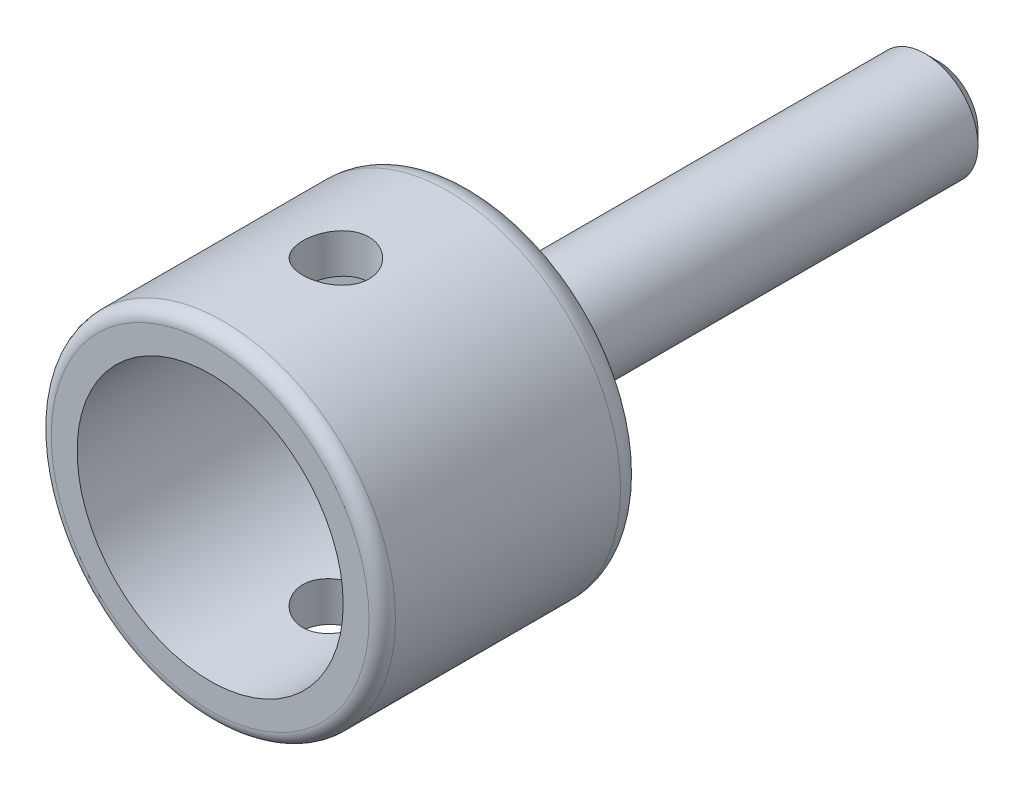
from build123d import *

# Parameters (mm, degrees)
SKETCH1_R           = 13
BOSS_EXTRUDE1_DEPTH = 20
SKETCH2_R           = 10.05
CUT_EXTRUDE1_DEPTH  = 15
SKETCH3_R           = 4
BOSS_EXTRUDE2_DEPTH = 35
FILLET1_R           = 2
CHAMFER1_SIZE       = 1
FILLET2_R           = 1
SKETCH4_R           = 2.5
CUT_EXTRUDE2_DEPTH  = 20


with BuildPart() as part:
    # Sketch1 → Boss-Extrude1 (new body)
    with BuildSketch(Plane.XY):
        Circle(SKETCH1_R)
    extrude(amount=BOSS_EXTRUDE1_DEPTH)

    # Sketch2 → Cut-Extrude1 (cut)
    with BuildSketch(Plane.XY.offset(20)):
        Circle(SKETCH2_R)
    extrude(amount=-CUT_EXTRUDE1_DEPTH, mode=Mode.SUBTRACT)

    # Sketch3 → Boss-Extrude2 (add)
    with BuildSketch(Plane(origin=(0, 0, 0), x_dir=(-1, 0, 0), z_dir=(0, 0, -1))):
        Circle(SKETCH3_R)
    extrude(amount=BOSS_EXTRUDE2_DEPTH)

    # Fillet1
    fillet1_edges = [part.edges().sort_by_distance(p)[0] for p in [
        (-13, 0, 0),
        (4, 0, 0),
    ]]
    fillet(fillet1_edges, radius=FILLET1_R)

    # Chamfer1
    chamfer1_edges = [part.edges().sort_by_distance(p)[0] for p in [
        (4, 0, -35),
    ]]
    chamfer(chamfer1_edges, length=CHAMFER1_SIZE)

    # Fillet2
    fillet2_edges = [part.edges().sort_by_distance(p)[0] for p in [
        (-13, 0, 20),
    ]]
    fillet(fillet2_edges, radius=FILLET2_R)

    # Sketch4 → Cut-Extrude2 (cut, symmetric)
    with BuildSketch(Plane(origin=(0, 0, 0), x_dir=(1, 0, 0), z_dir=(0, 1, 0))):
        with Locations(Location((0, -10.5, 0), (0, 0, 270))):
            Circle(SKETCH4_R)
    extrude(amount=CUT_EXTRUDE2_DEPTH, both=True, mode=Mode.SUBTRACT)


solid = part.part
